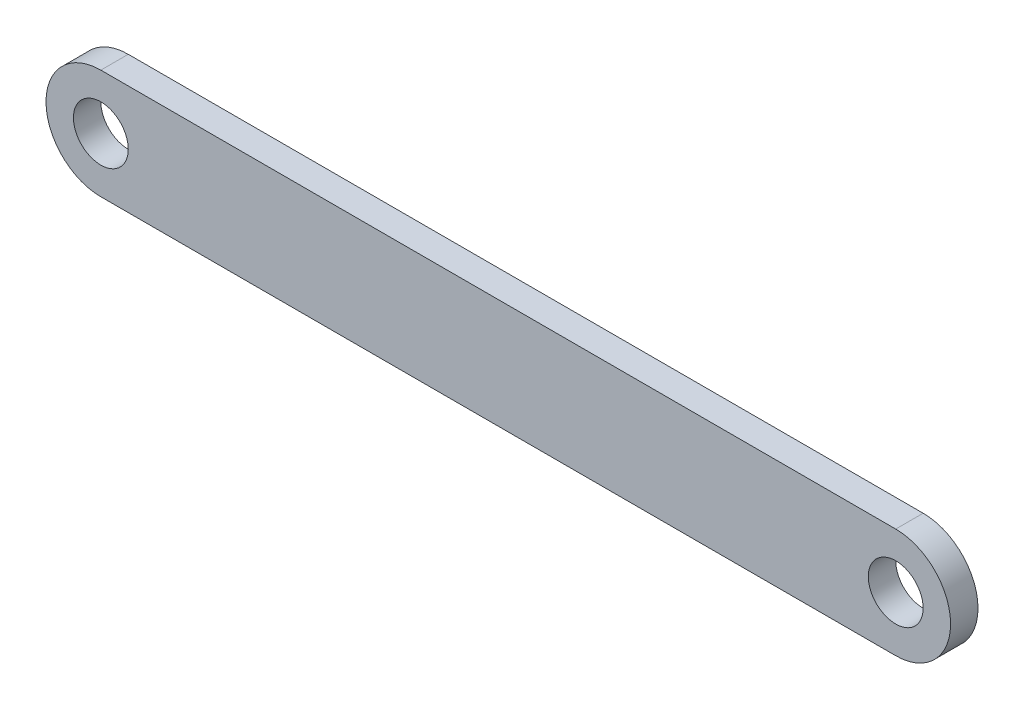
from build123d import *

# Parameters (mm, degrees)
SKETCH1_R      = 1
EXTRUDE1_DEPTH = 1


with BuildPart() as part:
    # Sketch1 → Extrude1 (new body)
    with BuildSketch(Plane.XY):
        with BuildLine():
            Line((0, 2), (-28.986, 2))
            ThreePointArc((-28.986, 2), (-30.986, 0), (-28.986, -2))
            Line((-28.986, -2), (0, -2))
            ThreePointArc((0, -2), (2, 0), (0, 2))
        make_face()
        with Locations((-28.986, 0)):
            Circle(SKETCH1_R, mode=Mode.SUBTRACT)
        Circle(SKETCH1_R, mode=Mode.SUBTRACT)
    extrude(amount=EXTRUDE1_DEPTH)


solid = part.part
